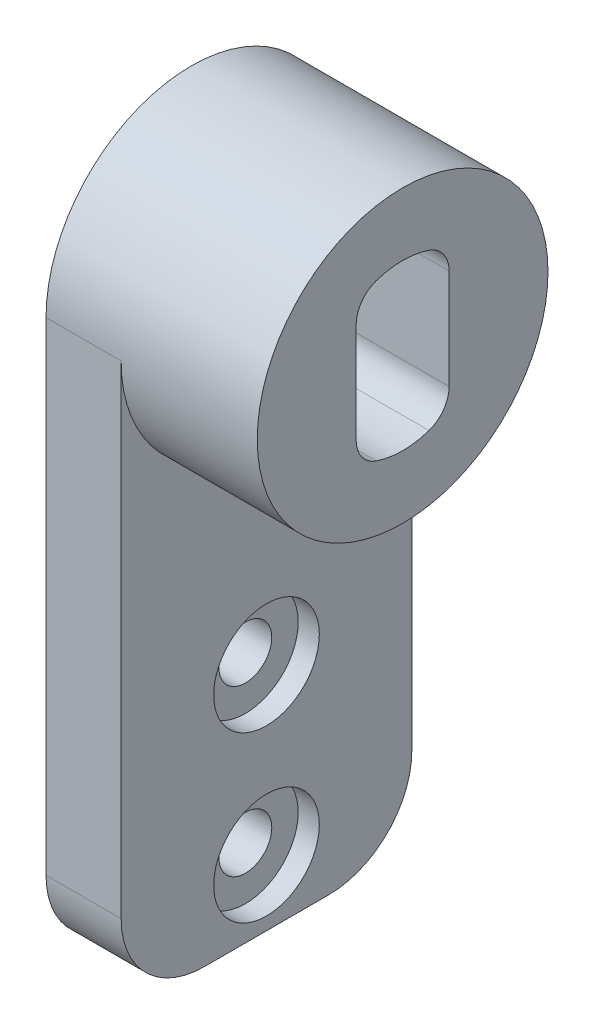
from build123d import *

# Parameters (mm, degrees)
SKETCH1_R           = 8.7376
BOSS_EXTRUDE1_DEPTH = 12.7
BOSS_EXTRUDE3_DEPTH = 4.516000112
FILLET2_R           = 5
CUT_EXTRUDE10_DEPTH = 12.192
SKETCH23_R          = 1.5875
CUT_EXTRUDE11_DEPTH = 38.364220181
CUT_EXTRUDE13_START = -1.27
SKETCH24_R          = 3.175
SKETCH24_R_2        = 1.5875
CUT_EXTRUDE13_DEPTH = 1.27
FILLET11_R          = 1.778


with BuildPart() as part:
    # Sketch1 → Boss-Extrude1 (new body)
    with BuildSketch(Plane.YZ):
        Circle(SKETCH1_R)
    extrude(amount=BOSS_EXTRUDE1_DEPTH)

    # Sketch10 → Boss-Extrude3 (add)
    with BuildSketch(Plane(origin=(0, 0, 0), x_dir=(0, -1, 0), z_dir=(-1, 0, 0))):
        with BuildLine():
            Line((34.036, 8.7376), (0, 8.7376))
            ThreePointArc((0, 8.7376), (8.7376, 0), (0, -8.7376))
            Line((0, -8.7376), (34.036, -8.7376))
            Line((34.036, -8.7376), (34.036, 8.7376))
        make_face()
    extrude(amount=-BOSS_EXTRUDE3_DEPTH)

    # Fillet2
    fillet2_edges = [part.edges().sort_by_distance(p)[0] for p in [
        (2.258000056, -34.036, 8.7376),
        (2.258000056, -34.036, -8.7376),
    ]]
    fillet(fillet2_edges, radius=FILLET2_R)

    # Sketch22 → Cut-Extrude10 (cut)
    with BuildSketch(Plane.YZ.offset(12.7)):
        with BuildLine():
            Line((-4.089715516, -2.794), (4.089715516, -2.794))
            ThreePointArc((4.089715516, -2.794), (4.953, 0), (4.089715516, 2.794))
            Line((4.089715516, 2.794), (-4.089715516, 2.794))
            ThreePointArc((-4.089715516, 2.794), (-4.953, 0), (-4.089715516, -2.794))
        make_face()
    extrude(amount=-CUT_EXTRUDE10_DEPTH, mode=Mode.SUBTRACT)

    # Sketch23 → Cut-Extrude11 (cut, through all)
    with BuildSketch(Plane.ZY):
        with Locations((0, -30.089710358)):
            Circle(SKETCH23_R)
        with Locations((0, -20.184348406)):
            Circle(SKETCH23_R)
    extrude(amount=-CUT_EXTRUDE11_DEPTH, mode=Mode.SUBTRACT)

    # Sketch24 → Cut-Extrude13 (cut)
    # profile 1 of 2: a face of its own
    with BuildSketch(Plane.YZ.offset(4.516000112).offset(CUT_EXTRUDE13_START)):
        with Locations((-20.184348406, 0)):
            Circle(SKETCH24_R)
        with Locations((-20.184348406, 0)):
            Circle(SKETCH24_R_2, mode=Mode.SUBTRACT)
    # profile 2 of 2: a face of its own
    with BuildSketch(Plane.YZ.offset(4.516000112).offset(CUT_EXTRUDE13_START)):
        with Locations((-30.089710358, 0)):
            Circle(SKETCH24_R)
    extrude(amount=CUT_EXTRUDE13_DEPTH, mode=Mode.SUBTRACT)

    # Fillet11
    fillet11_edges = [part.edges().sort_by_distance(p)[0] for p in [
        (6.604, 4.089715516, -2.794),
        (6.604, 4.089715516, 2.794),
        (6.604, -4.089715516, -2.794),
        (6.604, -4.089715516, 2.794),
    ]]
    fillet(fillet11_edges, radius=FILLET11_R)


solid = part.part
